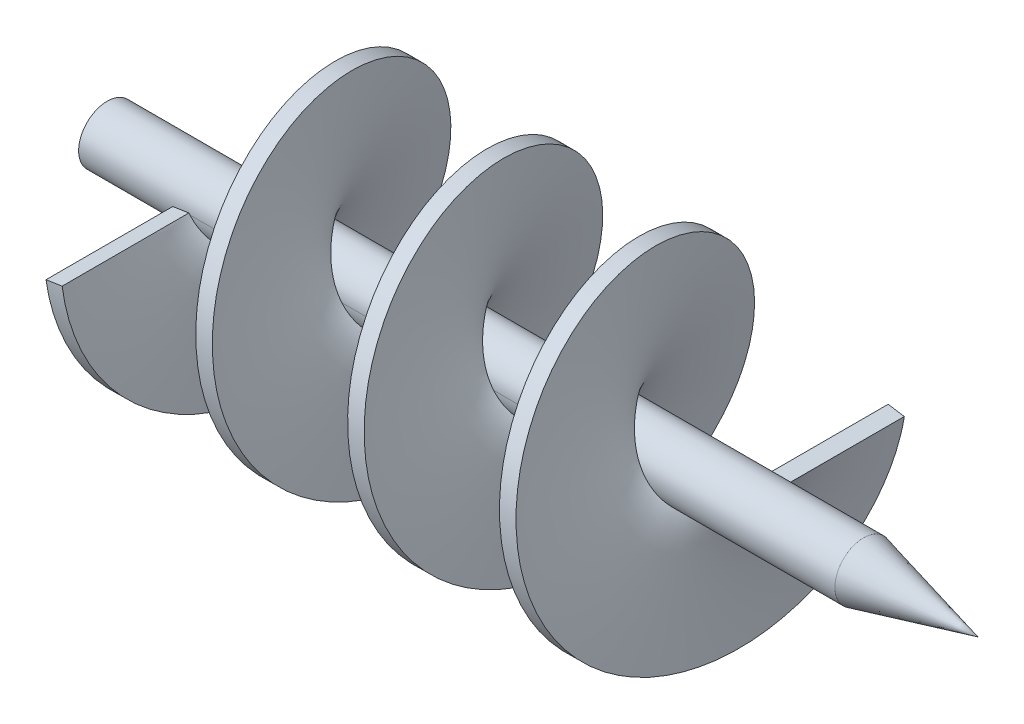
from build123d import *

# Parameters (mm, degrees)
SWEEP1_PITCH  = 7.428571429
SWEEP1_HEIGHT = 26
SWEEP1_RADIUS = 7.6
SKETCH3_W     = 0.8
SKETCH3_H     = 7.6


with BuildPart() as part:
    # Sketch1 → Revolve1 (revolve)
    with BuildSketch(Plane.XY, mode=Mode.PRIVATE) as revolve1_sk:
        Polygon((-23.914285714, 0), (18.685714286, 0), (13.085714286, 1.4), (-23.914285714, 1.4), align=None)
    revolve(revolve1_sk.sketch.rotate(Axis((-23.914285714, 0, 0), (1, 0, 0)), 90), axis=Axis((-23.914285714, 0, 0), (1, 0, 0)))

    # Sweep1: sweep along a helix
    with BuildLine() as sweep1_path:
        Helix(SWEEP1_PITCH, SWEEP1_HEIGHT, SWEEP1_RADIUS, center=(-18.914285714, 0, 0), direction=(1, 0, 0))
    # Sketch3 → Sweep1 (sweep)
    with BuildSketch(Plane(origin=(-18.914285714, 0, 7.6), x_dir=(-0.9881150542408101, -0.15371610059678492, 0), z_dir=(0.15371610059678492, -0.9881150542408103, 0))):
        with Locations((0, 3.8)):
            Rectangle(SKETCH3_W, SKETCH3_H)
    sweep(path=sweep1_path.line, is_frenet=True)


solid = part.part
